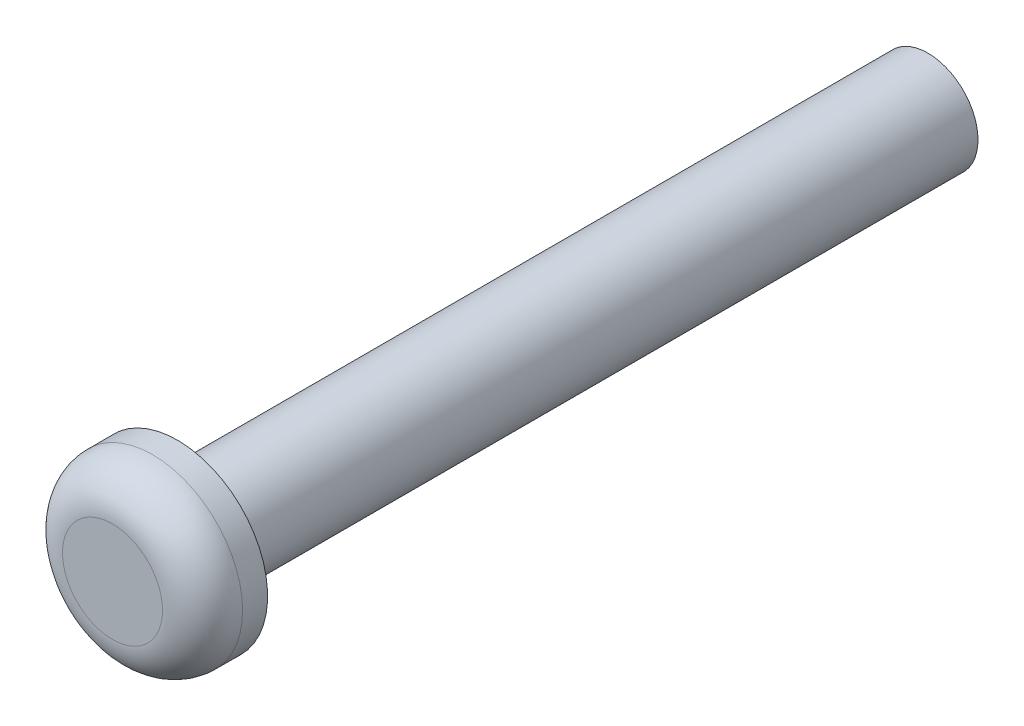
from build123d import *

# Parameters (mm, degrees)
SKETCH1_R           = 9
BOSS_EXTRUDE1_DEPTH = 6.5
FILLET1_R           = 4
SKETCH2_R           = 5
BOSS_EXTRUDE2_DEPTH = 75


with BuildPart() as part:
    # Sketch1 → Boss-Extrude1 (new body)
    with BuildSketch(Plane.XY):
        with Locations(Location((0, 0, 0), (0, 0, 180))):
            Circle(SKETCH1_R)
    extrude(amount=BOSS_EXTRUDE1_DEPTH)

    # Fillet1
    fillet1_edges = [part.edges().sort_by_distance(p)[0] for p in [
        (9, 0, 6.5),
    ]]
    fillet(fillet1_edges, radius=FILLET1_R)

    # Sketch2 → Boss-Extrude2 (add)
    with BuildSketch(Plane(origin=(0, 0, 0), x_dir=(-1, 0, 0), z_dir=(0, 0, -1))):
        with Locations(Location((0, 0, 0), (0, 0, 180))):
            Circle(SKETCH2_R)
    extrude(amount=BOSS_EXTRUDE2_DEPTH)


solid = part.part
